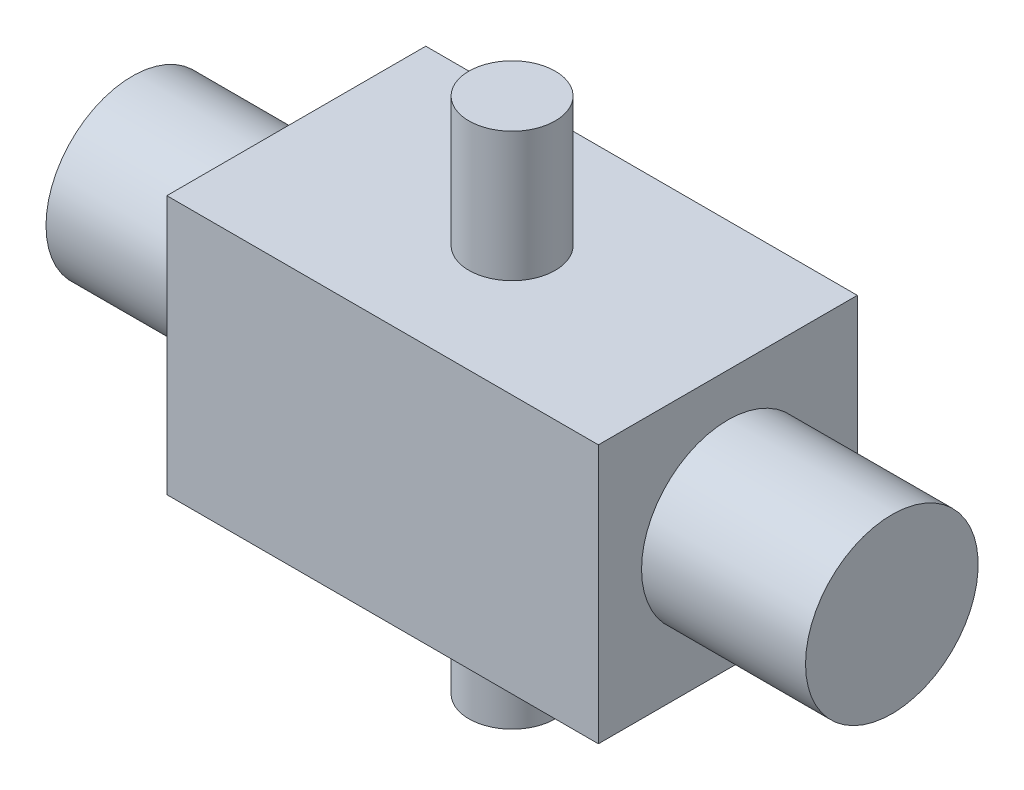
from build123d import *

# Parameters (mm, degrees)
SKETCH_1_W      = 88
SKETCH_1_H      = 10
SKETCH_3_W      = 5
SKETCH_3_H      = 60
SKETCH_4_W      = 30
SKETCH_4_H      = 30
EXTRUDE_1_DEPTH = 25


with BuildPart() as part:
    # 草图1 → 旋转1 (revolve)
    with BuildSketch(Plane.XY, mode=Mode.PRIVATE) as revolve_1_sk:
        Rectangle(SKETCH_1_W, SKETCH_1_H)
    revolve(revolve_1_sk.sketch.rotate(Axis((-44, -5, 0), (1, 0, 0)), 90), axis=Axis((-44, -5, 0), (1, 0, 0)))

    # 草图3 → 旋转2 (revolve)
    with BuildSketch(Plane.XY, mode=Mode.PRIVATE) as revolve_2_sk:
        with Locations((2.5, -5)):
            Rectangle(SKETCH_3_W, SKETCH_3_H)
    revolve(revolve_2_sk.sketch.rotate(Axis((0, -35, 0), (0, 1, 0)), 90), axis=Axis((0, -35, 0), (0, 1, 0)))

    # 草图4 → 凸台-拉伸1 (add, symmetric)
    with BuildSketch(Plane(origin=(0, 0, 0), x_dir=(0, 0, -1), z_dir=(1, 0, 0))):
        with Locations((0, -5)):
            Rectangle(SKETCH_4_W, SKETCH_4_H)
    extrude(amount=EXTRUDE_1_DEPTH, both=True)


solid = part.part
